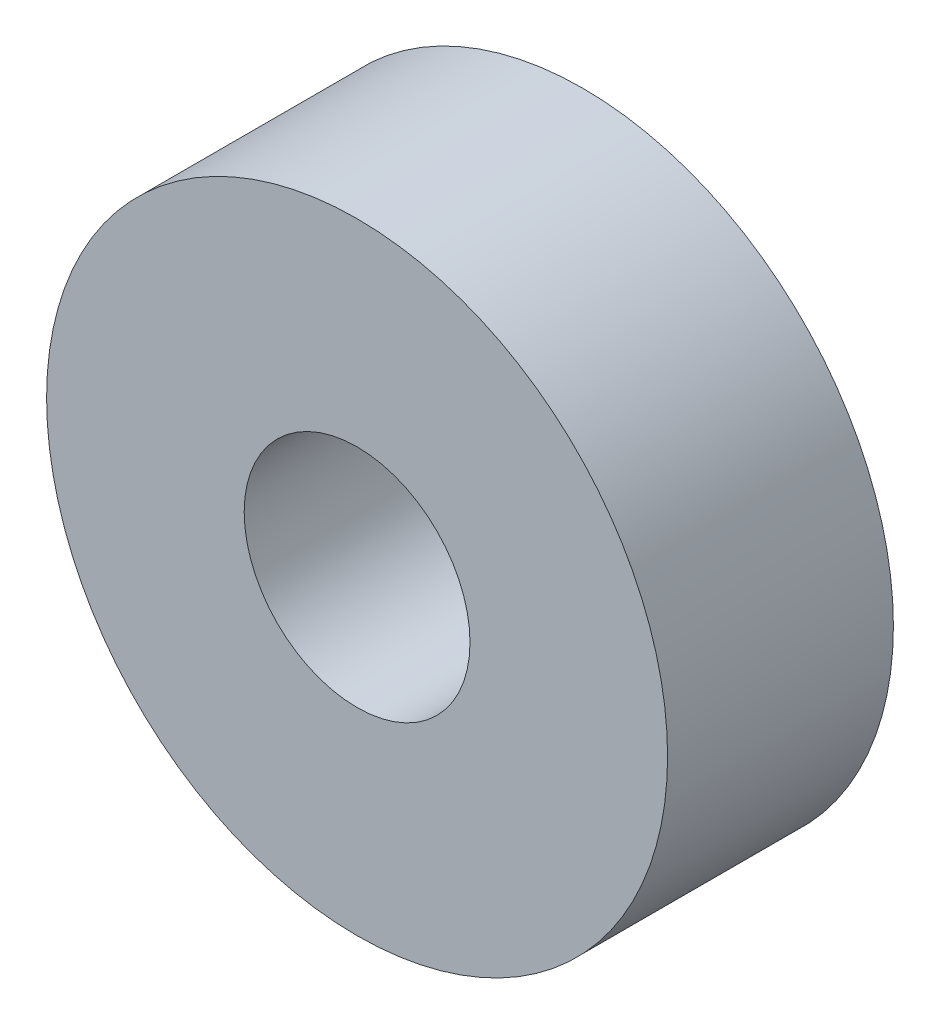
from build123d import *

# Parameters (mm, degrees)
ESQUISSE1_R        = 5.5
ESQUISSE1_R_2      = 2
BOSS_EXTRU_1_DEPTH = 4


with BuildPart() as part:
    # Esquisse1 → Boss.-Extru.1 (new body)
    with BuildSketch(Plane.XY):
        Circle(ESQUISSE1_R)
        Circle(ESQUISSE1_R_2, mode=Mode.SUBTRACT)
    extrude(amount=BOSS_EXTRU_1_DEPTH)


solid = part.part
